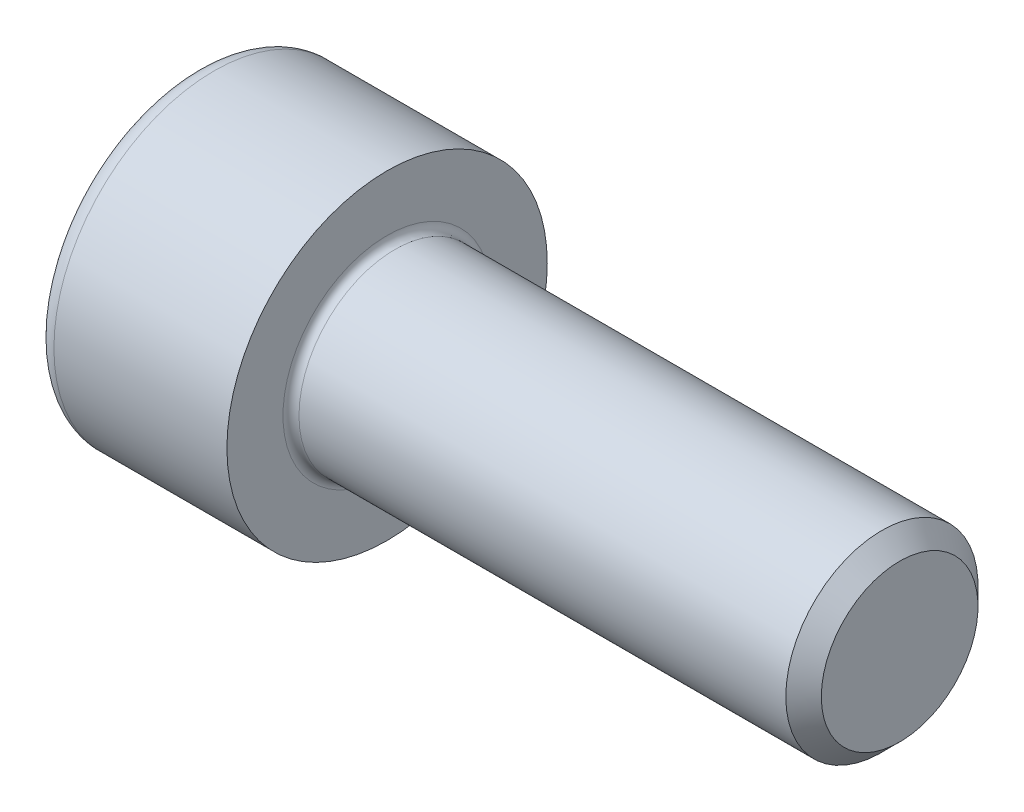
from build123d import *

# Parameters (mm, degrees)
BASEHEADSKE_R   = 5
BASEHEAD_DEPTH  = 6
CUTSOCKET_DEPTH = 3
FILLET1_R       = 0.25
FILLET2_R       = 0.6


with BuildPart() as part:
    # BaseHeadSke → BaseHead (new body)
    with BuildSketch(Plane(origin=(0, 0, 0), x_dir=(0, 0, -1), z_dir=(1, 0, 0))):
        Circle(BASEHEADSKE_R)
    extrude(amount=BASEHEAD_DEPTH)

    # BodySke → BaseBody (revolve)
    with BuildSketch(Plane.XY, mode=Mode.PRIVATE) as basebody_sk:
        Polygon((0, 0), (22, 0), (22, 2.4455), (21.4455, 3), (0, 3), align=None)
    revolve(basebody_sk.sketch.rotate(Axis((0, 0, 0), (1, 0, 0)), 90), axis=Axis((0, 0, 0), (1, 0, 0)))

    # CutSocketSke → CutSocket (cut)
    with BuildSketch(Plane(origin=(0, 0, 0), x_dir=(0, 0, -1), z_dir=(1, 0, 0))):
        Polygon((0, 2.886751346), (-2.5, 1.443375673), (-2.5, -1.443375673), (0, -2.886751346), (2.5, -1.443375673), (2.5, 1.443375673), align=None)
    extrude(amount=CUTSOCKET_DEPTH, mode=Mode.SUBTRACT)

    # CutHoleSke → CutHole (revolve, cut)
    with BuildSketch(Plane.XY, mode=Mode.PRIVATE) as cuthole_sk:
        Polygon((0, 2.5), (3.7, 2.5), (5.143375673, 0), (0, 0), align=None)
    revolve(cuthole_sk.sketch.rotate(Axis((0, 0, 0), (1, 0, 0)), 90), axis=Axis((0, 0, 0), (1, 0, 0)), mode=Mode.SUBTRACT)

    # Fillet1
    fillet1_edges = [part.edges().sort_by_distance(p)[0] for p in [
        (6, 0, -3),
    ]]
    fillet(fillet1_edges, radius=FILLET1_R)

    # Fillet2
    fillet2_edges = [part.edges().sort_by_distance(p)[0] for p in [
        (0, 0, 5),
    ]]
    fillet(fillet2_edges, radius=FILLET2_R)


solid = part.part
